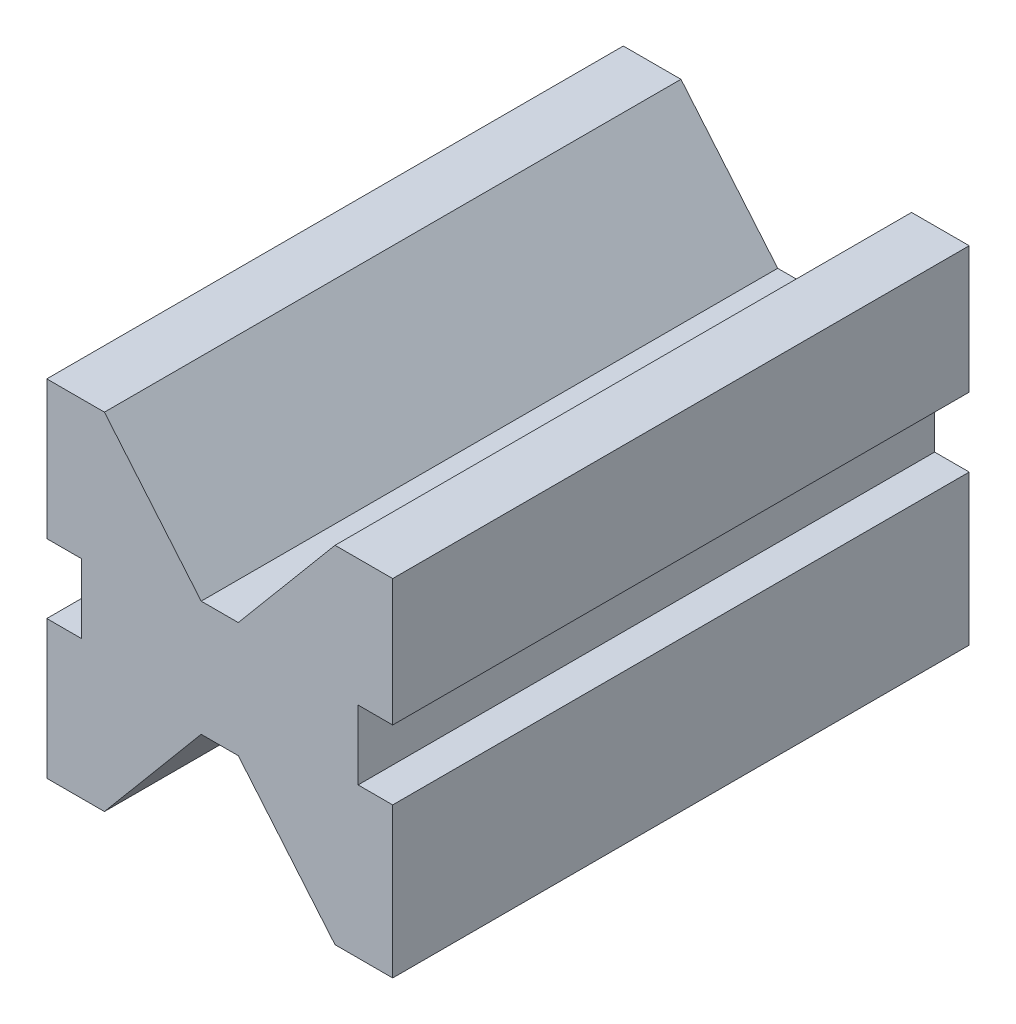
from build123d import *

# Parameters (mm, degrees)
Y_KSEKLIK_EKSTR_ZYON1_DEPTH = 100


with BuildPart() as part:
    # Çizim1 → Yükseklik-Ekstrüzyon1 (new body)
    with BuildSketch(Plane.XY):
        Polygon((-50, 60), (-33.218007376, 40), (-26.781992624, 40), (-10, 60), (0, 60), (0, 38.002554745), (-6, 38.002554745), (-6, 26.002554745), (0, 26.002554745), (0, 0), (-10, 0), (-26.781992624, 20), (-33.218007376, 20), (-50, 0), (-60, 0), (-60, 24), (-54, 24), (-54, 36), (-60, 36), (-60, 60), align=None)
    extrude(amount=Y_KSEKLIK_EKSTR_ZYON1_DEPTH)


solid = part.part
